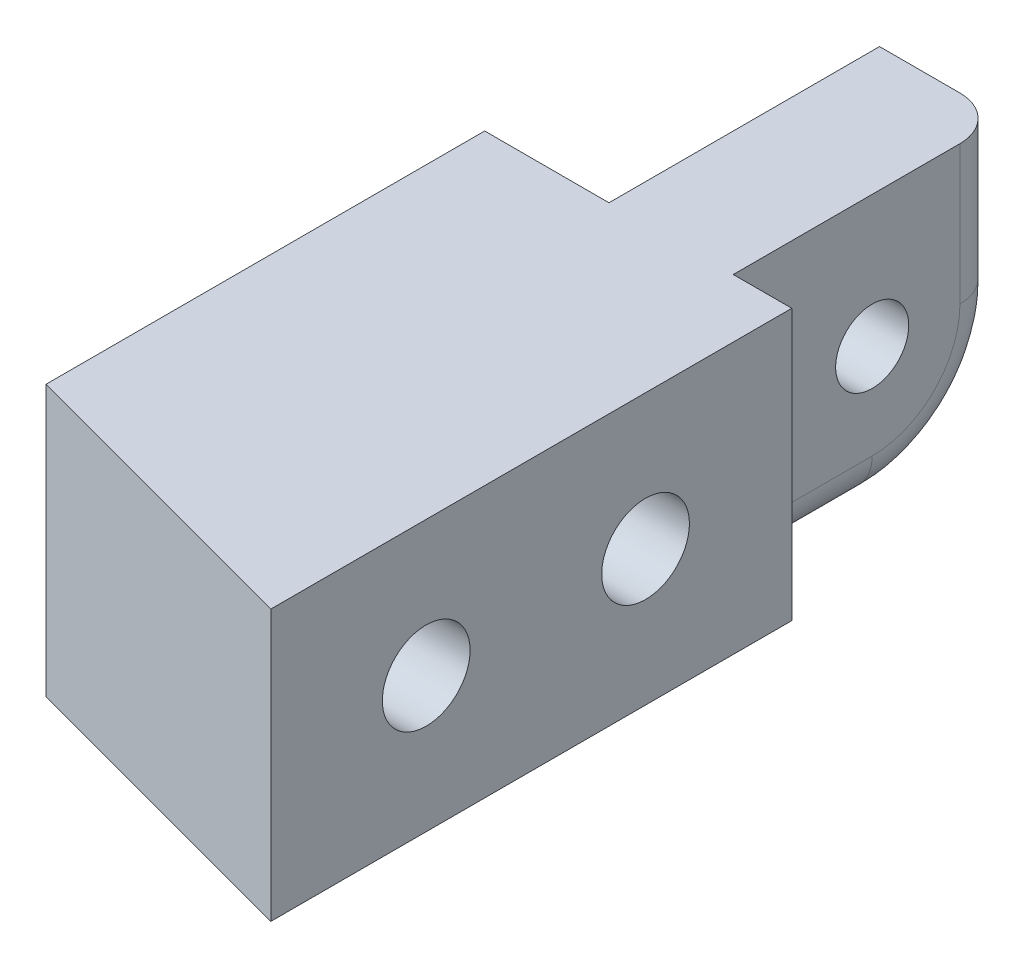
from build123d import *

# Parameters (mm, degrees)
BOSS_EXTRUDE1_DEPTH       = 18.5
CUT_EXTRUDE1_DEPTH        = 55.621424368
CUT_EXTRUDE1_DEPTH_BACK   = 8.5
FILLET1_R                 = 3
F_4_0MM_DOWEL_HOLE1_D     = 4
F_4_0MM_DOWEL_HOLE1_DEPTH = 31.5
F_4_0MM_DOWEL_HOLE1_TIP   = 1.201721238
CUT_EXTRUDE3_DEPTH        = 3.5
F_6_0MM_DOWEL_HOLE1_D     = 6
F_5_0MM_DOWEL_HOLE1_D     = 5


with BuildPart() as part:
    # Sketch2 → Boss-Extrude1 (new body)
    with BuildSketch(Plane(origin=(0, 0, 0), x_dir=(1, 0, 0), z_dir=(0, 1, 0))):
        Polygon((-10.5, 30), (-10.5, 0), (10.5, -5.626933041), (10.5, 30), (6.5, 30), (6.5, 48.5), (-2, 48.5), (-2, 30), align=None)
    extrude(amount=BOSS_EXTRUDE1_DEPTH)

    # Sketch3 → Cut-Extrude1 (cut, two sides: drawn at the far end of the back side and taken through both)
    with BuildSketch(Plane(origin=(6.5, 0, 0), x_dir=(0, 0, -1), z_dir=(1, 0, 0)).offset(-CUT_EXTRUDE1_DEPTH_BACK)):
        with BuildLine():
            Line((-80.408596214, 0), (39.5, 0))
            ThreePointArc((39.5, 0), (45.863961031, 2.636038969), (48.5, 9))
            Line((48.5, 9), (48.5, 128.908596214))
            Line((48.5, 128.908596214), (218.076363011, -40.667766797))
            Line((218.076363011, -40.667766797), (89.167766797, -169.576363011))
            Line((89.167766797, -169.576363011), (-80.408596214, 0))
        make_face()
    extrude(amount=CUT_EXTRUDE1_DEPTH + CUT_EXTRUDE1_DEPTH_BACK, mode=Mode.SUBTRACT)

    # Fillet1
    fillet1_edges = [part.edges().sort_by_distance(p)[0] for p in [
        (6.5, 13.75, -48.5),
        (6.5, 2.636038969, -45.863961031),
        (6.5, 0, -34.75),
    ]]
    fillet(fillet1_edges, radius=FILLET1_R)

    # Ø4.0mm Dowel Hole1
    with Locations(Plane(origin=(0, 0, -48.5), x_dir=(-1, 0, 0), z_dir=(0, 0, -1))):
        with Locations((-2.25, 3.5)):
            Hole(F_4_0MM_DOWEL_HOLE1_D / 2, depth=F_4_0MM_DOWEL_HOLE1_DEPTH)
            with Locations((0, 0, -(F_4_0MM_DOWEL_HOLE1_DEPTH + F_4_0MM_DOWEL_HOLE1_TIP / 2))):  # 118° drill point
                Cone(0, F_4_0MM_DOWEL_HOLE1_D / 2, F_4_0MM_DOWEL_HOLE1_TIP, mode=Mode.SUBTRACT)

    # Sketch8 → Cut-Extrude3 (cut)
    with BuildSketch(Plane.XZ):
        with BuildLine():
            Line((0.25, -48.5), (4.25, -48.5))
            Line((4.25, -48.5), (4.25, -31.5))
            ThreePointArc((4.25, -31.5), (2.25, -29.5), (0.25, -31.5))
            Line((0.25, -31.5), (0.25, -48.5))
        make_face()
        with BuildLine():
            Line((0.25, -22.5), (0.25, -19))
            ThreePointArc((0.25, -19), (2.25, -17), (4.25, -19))
            Line((4.25, -19), (4.25, -22.5))
            ThreePointArc((4.25, -22.5), (2.25, -24.5), (0.25, -22.5))
        make_face()
    extrude(amount=-CUT_EXTRUDE3_DEPTH, mode=Mode.SUBTRACT)

    # Ø6.0mm Dowel Hole1 (through all)
    with Locations(Plane(origin=(10.5, 0, 0), x_dir=(0, 0, -1), z_dir=(1, 0, 0))):
        with Locations((20, 9.25), (5, 9.25)):
            Hole(F_6_0MM_DOWEL_HOLE1_D / 2)

    # Ø5.0mm Dowel Hole1 (through all)
    with Locations(Plane(origin=(6.5, 0, 0), x_dir=(0, 0, -1), z_dir=(1, 0, 0))):
        with Locations((39.5, 9.5)):
            Hole(F_5_0MM_DOWEL_HOLE1_D / 2)


solid = part.part
